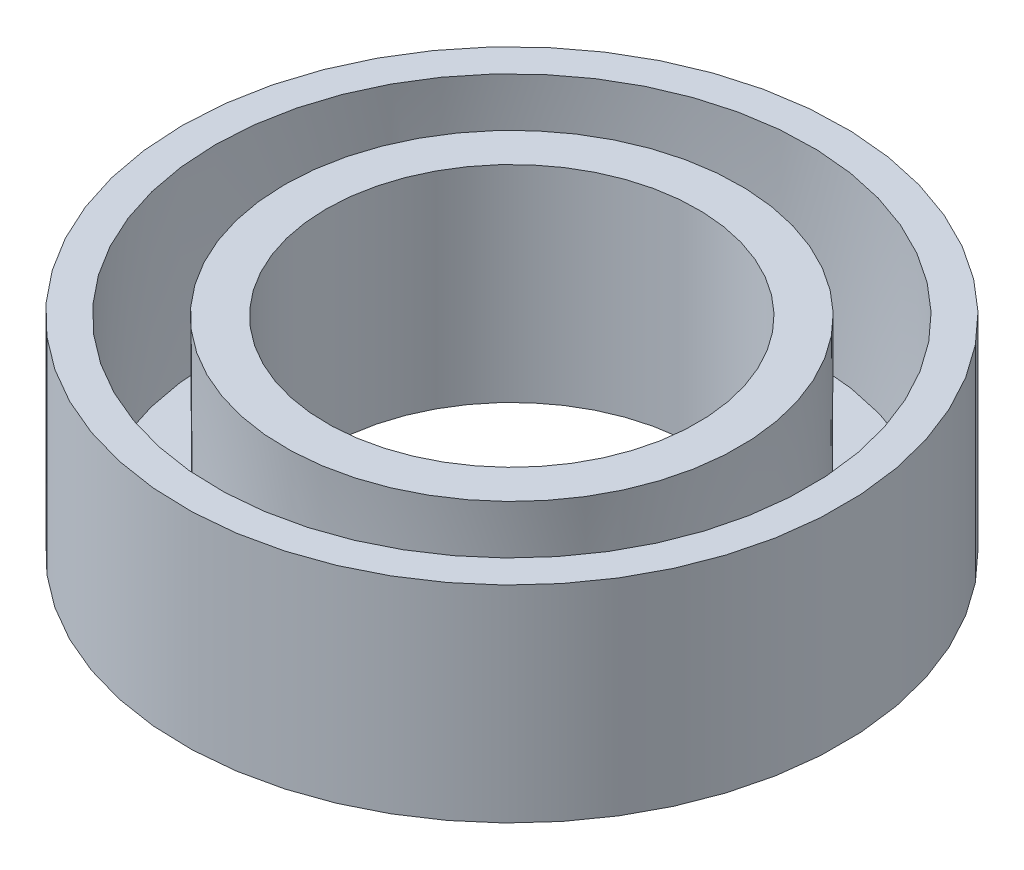
from build123d import *


with BuildPart() as part:
    # Sketch1 → Revolve3 (revolve)
    with BuildSketch(Plane.XY):
        with BuildLine():
            Line((-30.361445783, 3.504430058), (-30.361445783, 8.504430058))
            Line((-30.361445783, 8.504430058), (-31.376885957, 8.504430058))
            ThreePointArc((-31.376885957, 8.504430058), (-31.314742682, 6.237992883), (-31.355658186, 3.971073128))
            Line((-31.355658186, 3.971073128), (-33.073798324, 3.971073128))
            ThreePointArc((-33.073798324, 3.971073128), (-33.106676939, 6.237907358), (-33.056744184, 8.504430058))
            Line((-33.056744184, 8.504430058), (-33.861445783, 8.504430058))
            Line((-33.861445783, 8.504430058), (-33.861445783, 3.504430058))
            Line((-33.861445783, 3.504430058), (-30.361445783, 3.504430058))
        make_face()
    revolve(axis=Axis((-25.861445783, 61.686746988, 0), (0, -1, 0)))


solid = part.part
